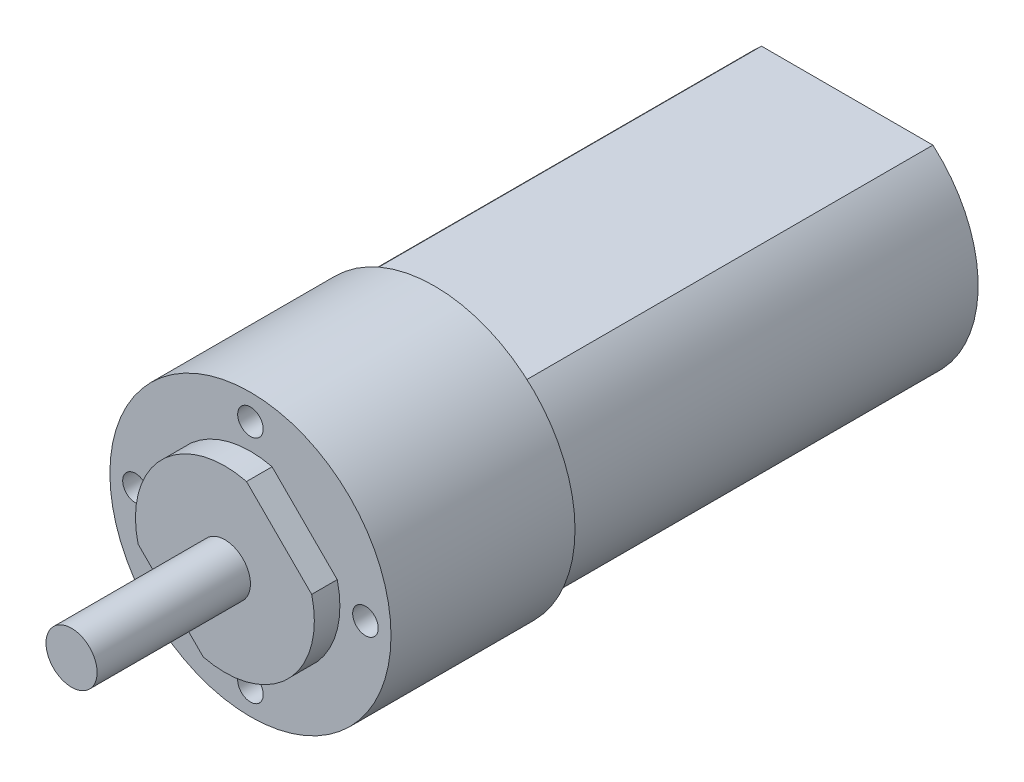
from build123d import *

# Parameters (mm, degrees)
BOSS_EXTRU_1_DEPTH      = 32.3
ESQUISSE2_R             = 11
BOSS_EXTRU_2_DEPTH      = 14.4
BOSS_EXTRU_3_DEPTH      = 2
ESQUISSE5_R             = 2
BOSS_EXTRU_4_DEPTH      = 12
ESQUISSE6_R             = 1
ENL_V_MAT_EXTRU_1_DEPTH = 4


with BuildPart() as part:
    # Esquisse1 → Boss.-Extru.1 (new body)
    with BuildSketch(Plane.XY):
        with BuildLine():
            Line((6.708203932, -7.75), (-6.708203932, -7.75))
            ThreePointArc((-6.708203932, -7.75), (-10.25, 0), (-6.708203932, 7.75))
            Line((-6.708203932, 7.75), (6.708203932, 7.75))
            ThreePointArc((6.708203932, 7.75), (10.25, 0), (6.708203932, -7.75))
        make_face()
    extrude(amount=BOSS_EXTRU_1_DEPTH)

    # Esquisse2 → Boss.-Extru.2 (add)
    with BuildSketch(Plane.XY.offset(32.3)):
        Circle(ESQUISSE2_R)
    extrude(amount=BOSS_EXTRU_2_DEPTH)

    # Esquisse4 → Boss.-Extru.3 (add)
    with BuildSketch(Plane.XY.offset(46.7)):
        with BuildLine():
            Line((-1.69313093, -6.792150444), (-6.792150444, -1.69313093))
            ThreePointArc((-6.792150444, -1.69313093), (-4.949747468, 4.949747468), (1.69313093, 6.792150444))
            Line((1.69313093, 6.792150444), (6.792150444, 1.69313093))
            ThreePointArc((6.792150444, 1.69313093), (4.949747468, -4.949747468), (-1.69313093, -6.792150444))
        make_face()
    extrude(amount=BOSS_EXTRU_3_DEPTH)

    # Esquisse5 → Boss.-Extru.4 (add)
    with BuildSketch(Plane.XY.offset(48.7)):
        with Locations(Location((0, 0, 0), (0, 0, 180))):
            Circle(ESQUISSE5_R)
    extrude(amount=BOSS_EXTRU_4_DEPTH)

    # Esquisse6 → Enlèv. mat.-Extru.1 (cut)
    with BuildSketch(Plane.XY.offset(46.7)):
        with Locations((-9, 0)):
            Circle(ESQUISSE6_R)
        with Locations((0, 9)):
            Circle(ESQUISSE6_R)
        with Locations((9, 0)):
            Circle(ESQUISSE6_R)
        with Locations((0, -9)):
            Circle(ESQUISSE6_R)
    extrude(amount=-ENL_V_MAT_EXTRU_1_DEPTH, mode=Mode.SUBTRACT)


solid = part.part
